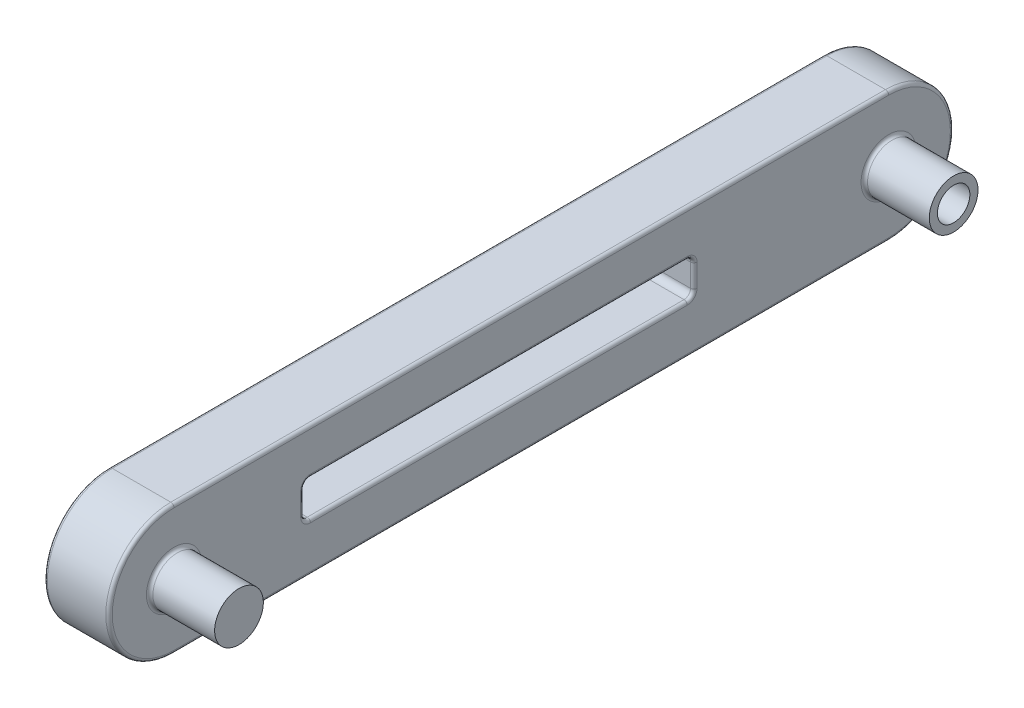
from build123d import *

# Parameters (mm, degrees)
SKETCH_1_R          = 3.75
EXTRUDE_1_DEPTH     = 10
SKETCH_2_R          = 3.75
EXTRUDE_2_DEPTH     = 10
SKETCH_3_R          = 2.5
CUT_EXTRUDE_1_DEPTH = 123.065556157
SKETCH_4_W          = 60
SKETCH_4_H          = 5.5
CUT_EXTRUDE_2_DEPTH = 10
FILLET_1_R          = 1
FILLET_2_R          = 0.5


with BuildPart() as part:
    # 草图1 → 凸台-拉伸1 (new body)
    with BuildSketch(Plane(origin=(0, 0, 0), x_dir=(0, 0, -1), z_dir=(1, 0, 0))):
        with BuildLine():
            Line((0, 10), (110, 10))
            ThreePointArc((110, 10), (120, 0), (110, -10))
            Line((110, -10), (0, -10))
            ThreePointArc((0, -10), (-10, 0), (0, 10))
        make_face()
        Circle(SKETCH_1_R, mode=Mode.SUBTRACT)
        with Locations((110, 0)):
            Circle(SKETCH_1_R, mode=Mode.SUBTRACT)
    extrude(amount=EXTRUDE_1_DEPTH)

    # 草图2 → 凸台-拉伸2 (add, symmetric)
    with BuildSketch(Plane(origin=(10, 0, 0), x_dir=(0, 0, -1), z_dir=(1, 0, 0))):
        with Locations((110, 0)):
            Circle(SKETCH_2_R)
        Circle(SKETCH_2_R)
    extrude(amount=EXTRUDE_2_DEPTH, both=True)

    # 草图3 → 切除-拉伸1 (cut, through all)
    with BuildSketch(Plane.ZY):
        with Locations((-110, 0)):
            Circle(SKETCH_3_R)
    extrude(amount=-CUT_EXTRUDE_1_DEPTH, mode=Mode.SUBTRACT)

    # 草图4 → 切除-拉伸2 (cut)
    with BuildSketch(Plane.ZY):
        with Locations((-50, 0.25)):
            Rectangle(SKETCH_4_W, SKETCH_4_H)
    extrude(amount=-CUT_EXTRUDE_2_DEPTH, mode=Mode.SUBTRACT)

    # 圆角1
    fillet_1_edges = [part.edges().sort_by_distance(p)[0] for p in [
        (5, -2.5, -80),
        (5, 3, -80),
        (5, 3, -20),
        (5, -2.5, -20),
    ]]
    fillet(fillet_1_edges, radius=FILLET_1_R)

    # 圆角2
    fillet_2_edges = [part.edges().sort_by_distance(p)[0] for p in [
        (10, 0, 3.75),
        (10, 0, -120),
        (10, 0, -106.25),
        (10, 10, -55),
        (0, 0, -112.5),
        (10, 0, 10),
        (0, 10, -55),
        (0, 0, -120),
        (0, 0.25, -20),
        (10, 0.25, -20),
        (0, -10, -55),
        (0, -2.5, -50),
        (10, -2.5, -50),
        (0, 3, -50),
        (10, 3, -50),
        (0, 0, 10),
        (0, 0.25, -80),
        (10, 0.25, -80),
        (0, -2.207106781, -20.292893219),
        (10, -2.207106781, -20.292893219),
        (0, 2.707106781, -20.292893219),
        (10, 2.707106781, -20.292893219),
        (0, 2.707106781, -79.707106781),
        (10, 2.707106781, -79.707106781),
        (0, -2.207106781, -79.707106781),
        (10, -2.207106781, -79.707106781),
        (10, -10, -55),
    ]]
    fillet(fillet_2_edges, radius=FILLET_2_R)


solid = part.part
